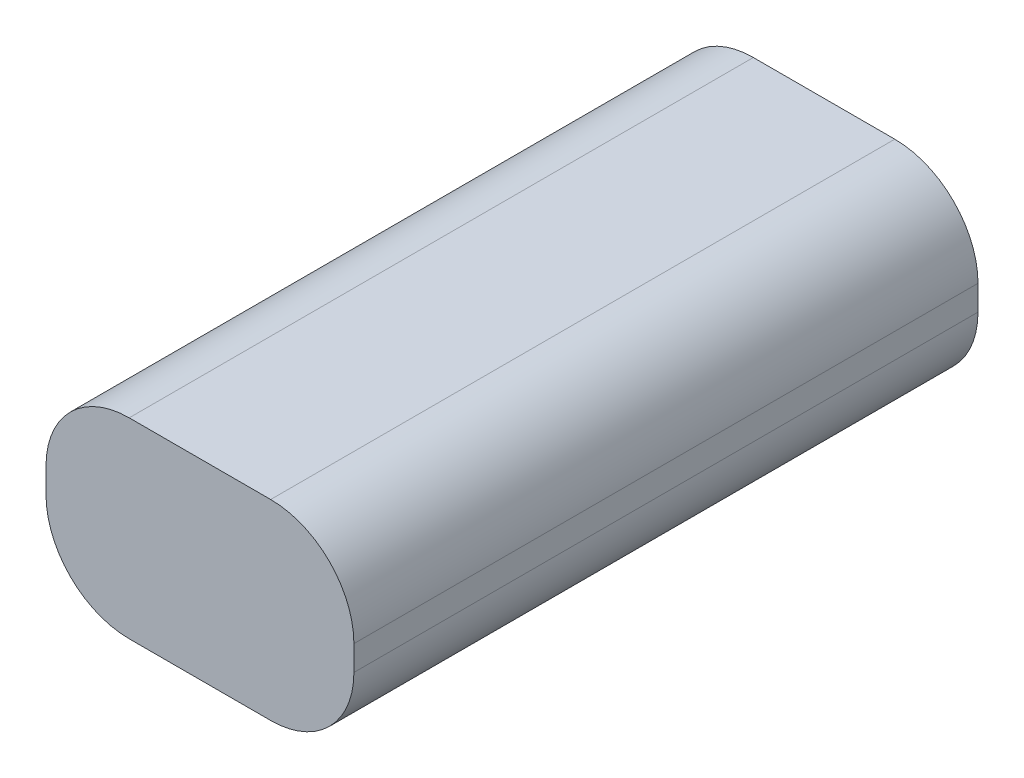
from build123d import *

# Parameters (mm, degrees)
SKETCH1_W           = 37
SKETCH1_H           = 75
BOSS_EXTRUDE1_DEPTH = 23
FILLET1_R           = 10


with BuildPart() as part:
    # Sketch1 → Boss-Extrude1 (new body)
    with BuildSketch(Plane(origin=(0, 0, 0), x_dir=(1, 0, 0), z_dir=(0, 1, 0))):
        Rectangle(SKETCH1_W, SKETCH1_H)
    extrude(amount=BOSS_EXTRUDE1_DEPTH)

    # Fillet1
    fillet1_edges = [part.edges().sort_by_distance(p)[0] for p in [
        (-18.5, 23, 0),
        (18.5, 23, 0),
        (-18.5, 0, 0),
        (18.5, 0, 0),
    ]]
    fillet(fillet1_edges, radius=FILLET1_R)


solid = part.part
